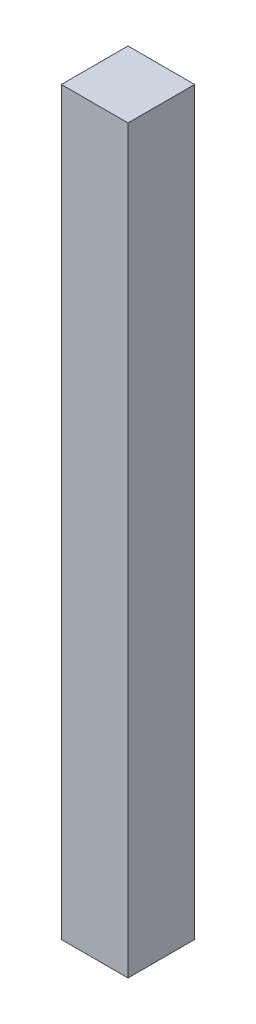
from build123d import *

# Parameters (mm, degrees)
TOPPING_KLAPE_KAT3_GAZLI_AMORTISOR_2_1_START = 8
SKETCH1_W                                    = 18
SKETCH1_H                                    = 200
TOPPING_KLAPE_KAT3_GAZLI_AMORTISOR_2_1_DEPTH = 18


with BuildPart() as part:
    # Sketch1 → TOPPING_klape_kat3_gazli_amortisor_2_1 (new body)
    with BuildSketch(Plane.XY.offset(TOPPING_KLAPE_KAT3_GAZLI_AMORTISOR_2_1_START)):
        with Locations((646, 870)):
            Rectangle(SKETCH1_W, SKETCH1_H)
    extrude(amount=TOPPING_KLAPE_KAT3_GAZLI_AMORTISOR_2_1_DEPTH)


solid = part.part
